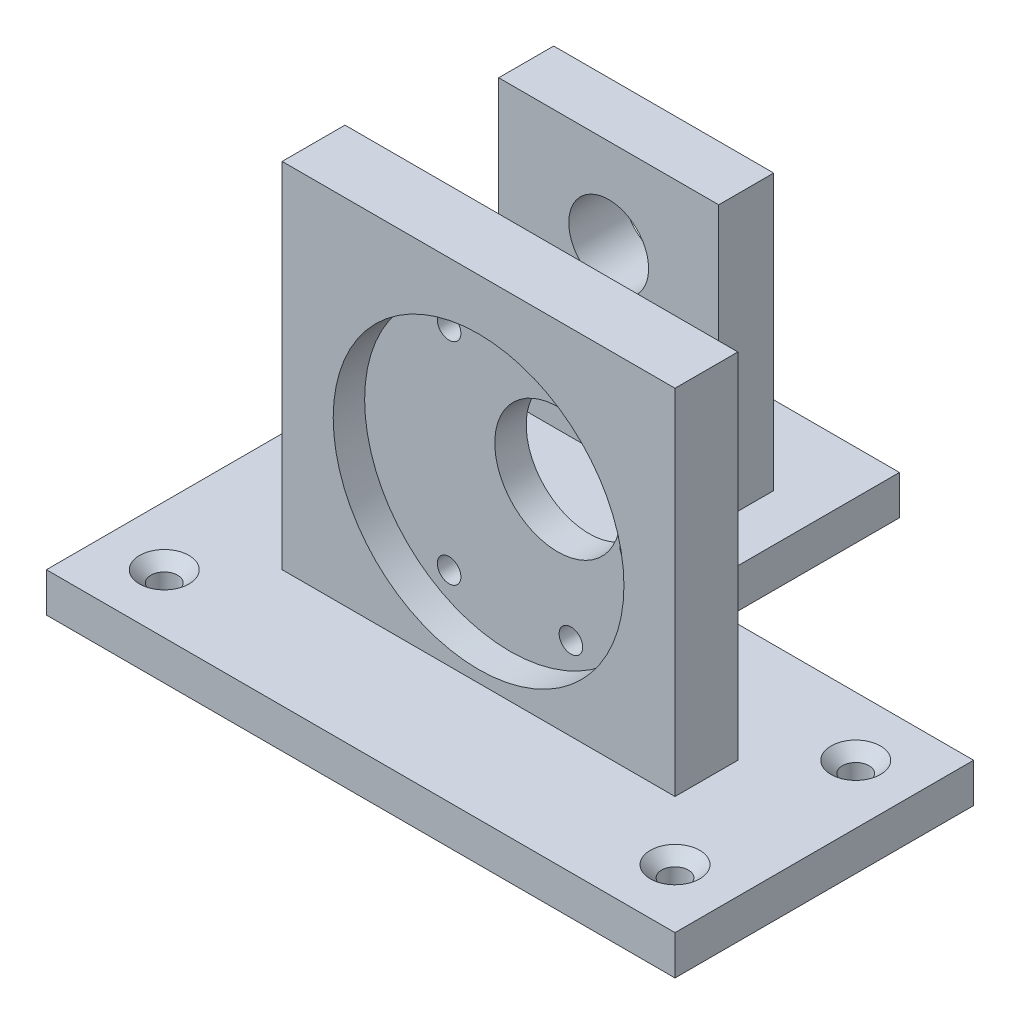
from build123d import *

# Parameters (mm, degrees)
SKETCH3_W                                       = 50
SKETCH3_H                                       = 50
BOSS_EXTRUDE1_DEPTH                             = 8
SKETCH3_3_R                                     = 1.5
SKETCH3_3_R_2                                   = 8
CUT_EXTRUDE2_DEPTH                              = 10
SKETCH4_R                                       = 18.5
CUT_EXTRUDE3_DEPTH                              = 4
BOSS_EXTRUDE2_DEPTH                             = 15
BOSS_EXTRUDE2_DEPTH_BACK                        = 23
SKETCH6_W                                       = 80
SKETCH6_H                                       = 5
CSK_FOR_M3_FLAT_HEAD_MACHINE_SCREW1_D           = 3.4
CSK_FOR_M3_FLAT_HEAD_MACHINE_SCREW1_CSINK_D     = 6.3
CSK_FOR_M3_FLAT_HEAD_MACHINE_SCREW1_CSINK_ANGLE = 90
SKETCH11_R                                      = 6.08
SKETCH11_R_2                                    = 5.08
BOSS_EXTRUDE3_DEPTH                             = 5
BOSS_EXTRUDE4_DEPTH                             = 10
SKETCH13_W                                      = 28
SKETCH13_H                                      = 35
SKETCH13_R                                      = 5.08
BOSS_EXTRUDE5_DEPTH                             = 7
SKETCH14_W                                      = 40
SKETCH14_H                                      = 5
BOSS_EXTRUDE6_DEPTH                             = 17


with BuildPart() as part:
    # Sketch3 → Boss-Extrude1 (new body)
    with BuildSketch(Plane.XY):
        with Locations((0, 25)):
            Rectangle(SKETCH3_W, SKETCH3_H)
    extrude(amount=BOSS_EXTRUDE1_DEPTH)

    # Sketch3<3> → Cut-Extrude2 (cut)
    with BuildSketch(Plane.XY):
        with Locations((-7.75, 38.423393759)):
            Circle(SKETCH3_3_R)
        with Locations((7.75, 38.423393759)):
            Circle(SKETCH3_3_R)
        with Locations((-7.75, 11.576606241)):
            Circle(SKETCH3_3_R)
        with Locations((7.75, 11.576606241)):
            Circle(SKETCH3_3_R)
        with Locations((15.5, 25)):
            Circle(SKETCH3_3_R)
        with Locations((6.062177825, 28.499999999)):
            Circle(SKETCH3_3_R_2)
    extrude(amount=CUT_EXTRUDE2_DEPTH, mode=Mode.SUBTRACT)

    # Sketch4 → Cut-Extrude3 (cut)
    with BuildSketch(Plane.XY.offset(8)):
        with Locations((0, 25)):
            Circle(SKETCH4_R)
    extrude(amount=-CUT_EXTRUDE3_DEPTH, mode=Mode.SUBTRACT)

    # Sketch6 → Boss-Extrude2 (add, two sides: drawn at the far end of the back side and taken through both)
    with BuildSketch(Plane.XY.offset(8).offset(-BOSS_EXTRUDE2_DEPTH_BACK)):
        with Locations((0, 2.5)):
            Rectangle(SKETCH6_W, SKETCH6_H)
    extrude(amount=BOSS_EXTRUDE2_DEPTH + BOSS_EXTRUDE2_DEPTH_BACK)

    # CSK for M3 Flat Head Machine Screw1 (through all)
    with Locations(Plane(origin=(0, 5, 0), x_dir=(1, 0, 0), z_dir=(0, 1, 0))):
        with Locations((-32.5, 7.5), (-32.5, -15.5), (32.5, -15.5), (32.5, 7.5)):
            CounterSinkHole(CSK_FOR_M3_FLAT_HEAD_MACHINE_SCREW1_D / 2, CSK_FOR_M3_FLAT_HEAD_MACHINE_SCREW1_CSINK_D / 2, counter_sink_angle=CSK_FOR_M3_FLAT_HEAD_MACHINE_SCREW1_CSINK_ANGLE)

    # Sketch11 → Boss-Extrude3 (add)
    with BuildSketch(Plane(origin=(0, 0, 0), x_dir=(-1, 0, 0), z_dir=(0, 0, -1))):
        with Locations((16.437822175, 28.499999999)):
            Circle(SKETCH11_R)
        with Locations((16.437822175, 28.499999999)):
            Circle(SKETCH11_R_2, mode=Mode.SUBTRACT)
    extrude(amount=BOSS_EXTRUDE3_DEPTH)

    # Sketch12 → Boss-Extrude4 (add)
    with BuildSketch(Plane(origin=(0, 0, -15), x_dir=(-1, 0, 0), z_dir=(0, 0, -1))):
        Polygon((2.437822175, 5), (-3.562177825, 5), (-3.562177825, 0), (36.437822175, 0), (36.437822175, 5), (30.437822175, 5), align=None)
    extrude(amount=BOSS_EXTRUDE4_DEPTH)



with BuildPart() as body_2:
    # Sketch13 → Boss-Extrude5 (new body)
    with BuildSketch(Plane(origin=(0, 0, -25), x_dir=(-1, 0, 0), z_dir=(0, 0, -1))):
        with Locations((16.437822175, 22.5)):
            Rectangle(SKETCH13_W, SKETCH13_H)
        with Locations((16.437822175, 28.499999999)):
            Circle(SKETCH13_R, mode=Mode.SUBTRACT)
    extrude(amount=BOSS_EXTRUDE5_DEPTH)


with BuildPart() as part_1:
    add(part.part)

    add(body_2.part)  # Boss-Extrude6 merges body 2
    # Sketch14 → Boss-Extrude6 (add)
    with BuildSketch(Plane(origin=(0, 0, -25), x_dir=(-1, 0, 0), z_dir=(0, 0, -1))):
        with Locations((16.437822175, 2.5)):
            Rectangle(SKETCH14_W, SKETCH14_H)
    extrude(amount=BOSS_EXTRUDE6_DEPTH)


solid = part_1.part
